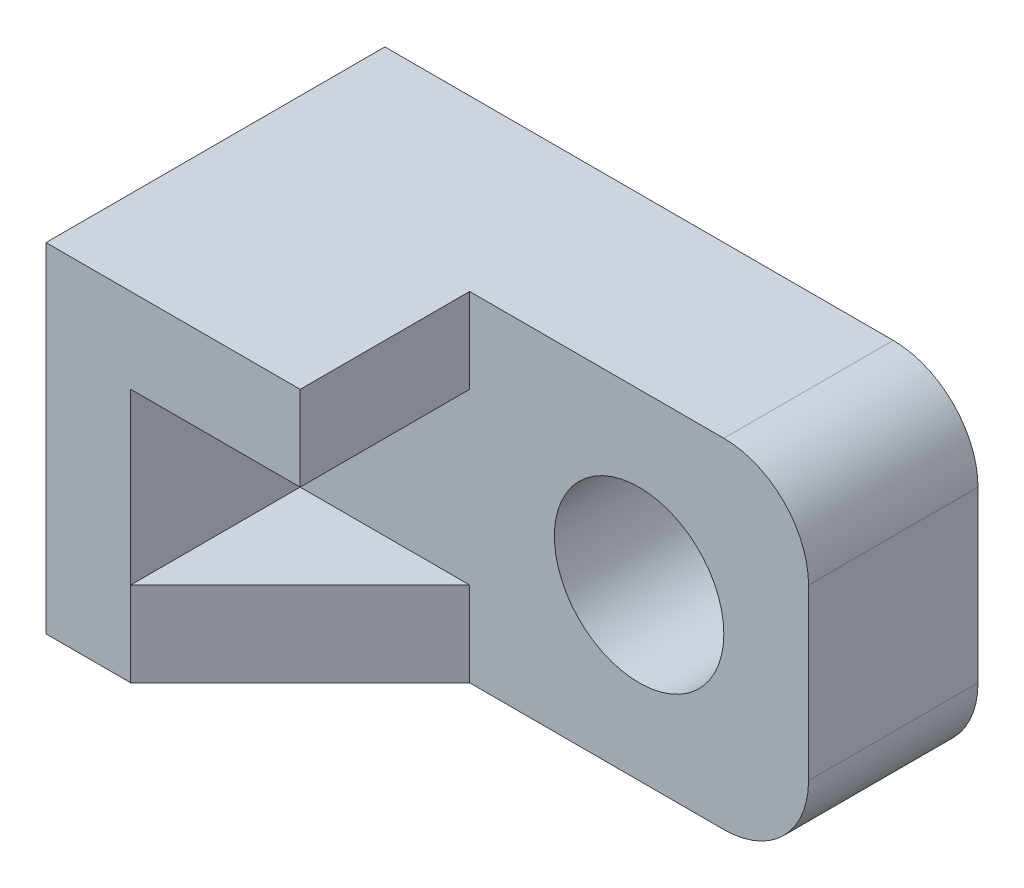
from build123d import *

# Parameters (mm, degrees)
SKETCH1_R           = 10
BOSS_EXTRUDE1_DEPTH = 20
BOSS_EXTRUDE2_DEPTH = 20
CUT_EXTRUDE1_REACH  = 92


with BuildPart() as part:
    # Sketch1 → Boss-Extrude1 (new body)
    with BuildSketch(Plane.XY):
        with BuildLine():
            Line((0, 20), (0, -20))
            Line((0, -20), (60, -20))
            ThreePointArc((60, -20), (67.071067812, -17.071067812), (70, -10))
            Line((70, -10), (70, 10))
            ThreePointArc((70, 10), (67.071067812, 17.071067812), (60, 20))
            Line((60, 20), (0, 20))
        make_face()
        with Locations((50, 0)):
            Circle(SKETCH1_R, mode=Mode.SUBTRACT)
    extrude(amount=BOSS_EXTRUDE1_DEPTH)

    # Sketch2 → Boss-Extrude2 (add)
    with BuildSketch(Plane.XY.offset(20)):
        Polygon((0, 20), (0, -20), (30, -20), (30, -10), (10, -10), (10, 10), (30, 10), (30, 20), align=None)
    extrude(amount=BOSS_EXTRUDE2_DEPTH)

    # Sketch3 → Cut-Extrude1 (cut, up to next)
    with BuildSketch(Plane.XZ.offset(20), mode=Mode.PRIVATE) as cut_extrude1_sk1:
        Polygon((10, 40), (30, 20), (30, 40), align=None)
    cut_extrude1_tool1 = extrude(cut_extrude1_sk1.sketch, amount=-CUT_EXTRUDE1_REACH, mode=Mode.PRIVATE) & part.part
    add(cut_extrude1_tool1.solids().sort_by_distance((23.333333, -20, 33.333333))[0], mode=Mode.SUBTRACT)


solid = part.part
